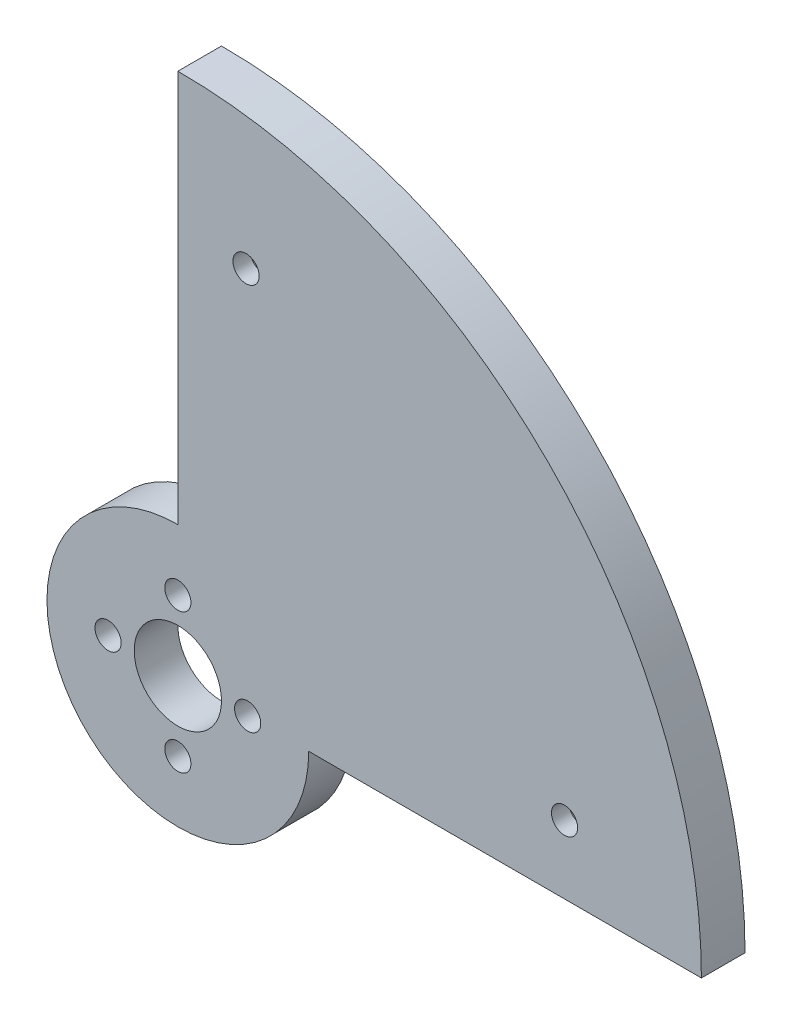
from build123d import *

# Parameters (mm, degrees)
BOSS_EXTRUDE1_DEPTH = 5
SKETCH2_R           = 15
BOSS_EXTRUDE2_DEPTH = 5
SKETCH3_R           = 5
CUT_EXTRUDE1_DEPTH  = 5
SKETCH4_R           = 1.5
CUT_EXTRUDE2_DEPTH  = 2
CUT_EXTRUDE3_DEPTH  = 2
SKETCH6_R           = 1.5
CUT_EXTRUDE4_DEPTH  = 10


with BuildPart() as part:
    # Sketch1 → Boss-Extrude1 (new body)
    with BuildSketch(Plane.XY):
        with BuildLine():
            Line((0, 0), (0, 60))
            ThreePointArc((0, 60), (42.426406871, 42.426406871), (60, 0))
            Line((60, 0), (0, 0))
        make_face()
    extrude(amount=BOSS_EXTRUDE1_DEPTH)

    # Sketch2 → Boss-Extrude2 (add)
    with BuildSketch(Plane.XY.offset(5)):
        Circle(SKETCH2_R)
    extrude(amount=-BOSS_EXTRUDE2_DEPTH)

    # Sketch3 → Cut-Extrude1 (cut)
    with BuildSketch(Plane.XY.offset(5)):
        Circle(SKETCH3_R)
    extrude(amount=-CUT_EXTRUDE1_DEPTH, mode=Mode.SUBTRACT)

    # Sketch4 → Cut-Extrude2 (cut)
    with BuildSketch(Plane.XY.offset(5)):
        with Locations((7.814167995, 44.316348886)):
            Circle(SKETCH4_R)
        with Locations((44.316348886, 7.814167995)):
            Circle(SKETCH4_R)
    extrude(amount=-CUT_EXTRUDE2_DEPTH, mode=Mode.SUBTRACT)

    # Sketch5 → Cut-Extrude3 (cut)
    with BuildSketch(Plane.XY):
        with BuildLine():
            Line((8.772167152, 35.789944904), (-0.110326549, 25.299716292))
            Line((-0.110326549, 25.299716292), (-0.035812461, 41.982184113))
            ThreePointArc((-0.035812461, 41.982184113), (4.507355312, 39.084034363), (8.772167152, 35.789944904))
        make_face()
    extrude(amount=CUT_EXTRUDE3_DEPTH, mode=Mode.SUBTRACT)

    # Sketch6 → Cut-Extrude4 (cut)
    with BuildSketch(Plane.XY.offset(5)):
        with Locations((0, 8)):
            Circle(SKETCH6_R)
        with Locations((8, 0)):
            Circle(SKETCH6_R)
        with Locations((0, -8)):
            Circle(SKETCH6_R)
        with Locations((-8, 0)):
            Circle(SKETCH6_R)
    extrude(amount=-CUT_EXTRUDE4_DEPTH, mode=Mode.SUBTRACT)


solid = part.part
